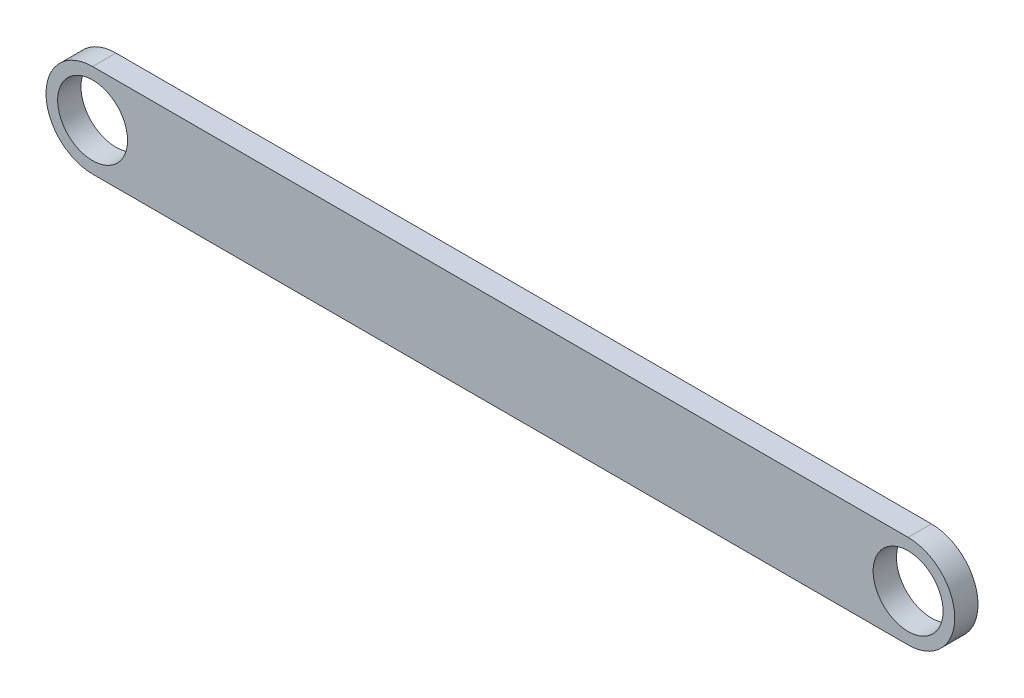
from build123d import *

# Parameters (mm, degrees)
SKETCH1_R           = 1.5
BOSS_EXTRUDE2_DEPTH = 0.5


with BuildPart() as part:
    # Sketch1 → Boss-Extrude2 (new, symmetric)
    with BuildSketch(Plane.XY):
        with BuildLine():
            Line((-62.547960717, 40.00320125), (-27.547960717, 40.00320125))
            ThreePointArc((-27.547960717, 40.00320125), (-25.547960717, 38.00320125), (-27.547960717, 36.00320125))
            Line((-27.547960717, 36.00320125), (-62.547960717, 36.00320125))
            ThreePointArc((-62.547960717, 36.00320125), (-64.547960717, 38.00320125), (-62.547960717, 40.00320125))
        make_face()
        with Locations((-62.547960717, 38.00320125)):
            Circle(SKETCH1_R, mode=Mode.SUBTRACT)
        with Locations((-27.547960717, 38.00320125)):
            Circle(SKETCH1_R, mode=Mode.SUBTRACT)
    extrude(amount=BOSS_EXTRUDE2_DEPTH, both=True)


solid = part.part
